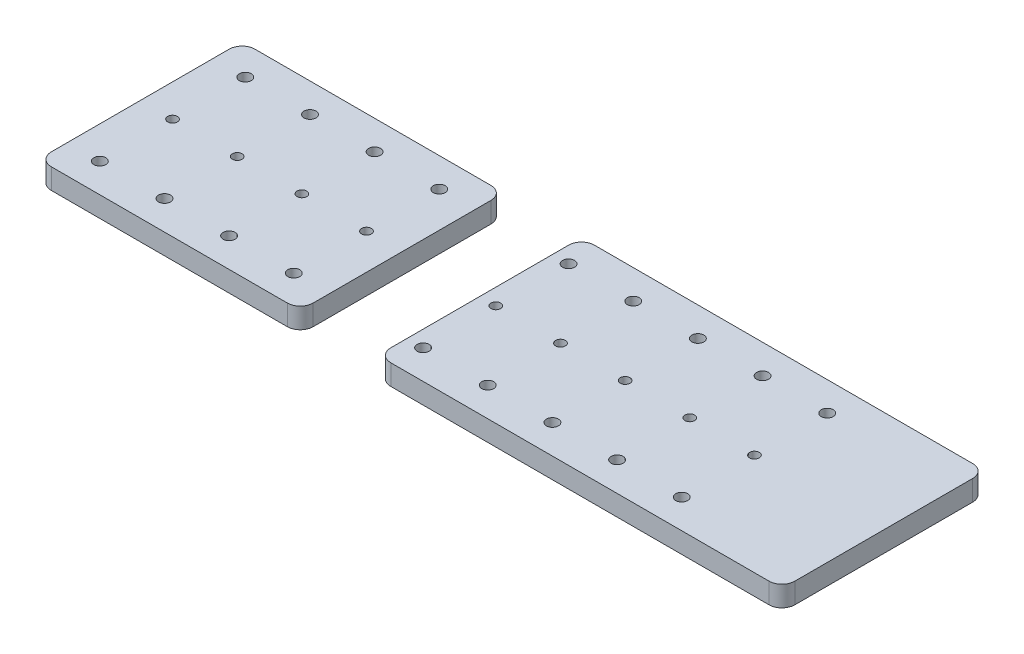
from build123d import *

# Parameters (mm, degrees)
SKETCH1_R           = 1.85
SKETCH1_R_2         = 1.5
BOSS_EXTRUDE1_DEPTH = 6.35
SKETCH3_W           = 24
SKETCH3_H           = 63
CUT_EXTRUDE1_DEPTH  = 233.233874575
FILLET1_R           = 4
FILLET2_R           = 4


with BuildPart() as part:
    # Sketch1 → Boss-Extrude1 (new body)
    with BuildSketch(Plane(origin=(0, 0, 0), x_dir=(1, 0, 0), z_dir=(0, 1, 0))):
        Polygon((0, 0), (0, 31.5), (230, 31.5), (230, -31.5), (0, -31.5), align=None)
        with Locations(Location((10, 22.5, 0), (0, 0, 270))):
            Circle(SKETCH1_R, mode=Mode.SUBTRACT)
        with Locations(Location((30, 22.5, 0), (0, 0, 270))):
            Circle(SKETCH1_R, mode=Mode.SUBTRACT)
        with Locations(Location((50, 22.5, 0), (0, 0, 270))):
            Circle(SKETCH1_R, mode=Mode.SUBTRACT)
        with Locations(Location((70, 22.5, 0), (0, 0, 270))):
            Circle(SKETCH1_R, mode=Mode.SUBTRACT)
        with Locations(Location((90, 22.5, 0), (0, 0, 270))):
            Circle(SKETCH1_R, mode=Mode.SUBTRACT)
        with Locations(Location((110, 22.5, 0), (0, 0, 270))):
            Circle(SKETCH1_R, mode=Mode.SUBTRACT)
        with Locations(Location((130, 22.5, 0), (0, 0, 270))):
            Circle(SKETCH1_R, mode=Mode.SUBTRACT)
        with Locations(Location((150, 22.5, 0), (0, 0, 270))):
            Circle(SKETCH1_R, mode=Mode.SUBTRACT)
        with Locations(Location((170, 22.5, 0), (0, 0, 270))):
            Circle(SKETCH1_R, mode=Mode.SUBTRACT)
        with Locations(Location((10, 0, 0), (0, 0, 270))):
            Circle(SKETCH1_R_2, mode=Mode.SUBTRACT)
        with Locations(Location((30, 0, 0), (0, 0, 270))):
            Circle(SKETCH1_R_2, mode=Mode.SUBTRACT)
        with Locations(Location((50, 0, 0), (0, 0, 270))):
            Circle(SKETCH1_R_2, mode=Mode.SUBTRACT)
        with Locations(Location((70, 0, 0), (0, 0, 270))):
            Circle(SKETCH1_R_2, mode=Mode.SUBTRACT)
        with Locations(Location((90, 0, 0), (0, 0, 270))):
            Circle(SKETCH1_R_2, mode=Mode.SUBTRACT)
        with Locations(Location((110, 0, 0), (0, 0, 270))):
            Circle(SKETCH1_R_2, mode=Mode.SUBTRACT)
        with Locations(Location((170, -22.5, 0), (0, 0, 90))):
            Circle(SKETCH1_R, mode=Mode.SUBTRACT)
        with Locations(Location((150, -22.5, 0), (0, 0, 90))):
            Circle(SKETCH1_R, mode=Mode.SUBTRACT)
        with Locations(Location((130, -22.5, 0), (0, 0, 90))):
            Circle(SKETCH1_R, mode=Mode.SUBTRACT)
        with Locations(Location((110, -22.5, 0), (0, 0, 90))):
            Circle(SKETCH1_R, mode=Mode.SUBTRACT)
        with Locations(Location((90, -22.5, 0), (0, 0, 90))):
            Circle(SKETCH1_R, mode=Mode.SUBTRACT)
        with Locations(Location((70, -22.5, 0), (0, 0, 90))):
            Circle(SKETCH1_R, mode=Mode.SUBTRACT)
        with Locations(Location((50, -22.5, 0), (0, 0, 90))):
            Circle(SKETCH1_R, mode=Mode.SUBTRACT)
        with Locations(Location((30, -22.5, 0), (0, 0, 90))):
            Circle(SKETCH1_R, mode=Mode.SUBTRACT)
        with Locations(Location((10, -22.5, 0), (0, 0, 90))):
            Circle(SKETCH1_R, mode=Mode.SUBTRACT)
        with Locations(Location((130, 0, 0), (0, 0, 270))):
            Circle(SKETCH1_R_2, mode=Mode.SUBTRACT)
        with Locations(Location((150, 0, 0), (0, 0, 270))):
            Circle(SKETCH1_R_2, mode=Mode.SUBTRACT)
        with Locations(Location((170, 0, 0), (0, 0, 270))):
            Circle(SKETCH1_R_2, mode=Mode.SUBTRACT)
        with Locations(Location((190, 22.5, 0), (0, 0, 270))):
            Circle(SKETCH1_R, mode=Mode.SUBTRACT)
        with Locations(Location((190, -22.5, 0), (0, 0, 90))):
            Circle(SKETCH1_R, mode=Mode.SUBTRACT)
        with Locations(Location((190, 0, 0), (0, 0, 270))):
            Circle(SKETCH1_R_2, mode=Mode.SUBTRACT)
    extrude(amount=BOSS_EXTRUDE1_DEPTH)

    # Sketch3 → Cut-Extrude1 (cut, through all)
    with BuildSketch(Plane(origin=(0, 6.35, 0), x_dir=(1, 0, 0), z_dir=(0, 1, 0))):
        with Locations((93, 0)):
            Rectangle(SKETCH3_W, SKETCH3_H)
    extrude(amount=-CUT_EXTRUDE1_DEPTH, mode=Mode.SUBTRACT)


with BuildPart() as cut_extrude1_piece_1:
    # of the separate pieces the step leaves, piece 1, a body of its own (cut_extrude1_pieces)
    add(part.part.solids().sort_by_distance((105, 0, -31.5))[0])

    # Fillet2
    fillet2_edges = [cut_extrude1_piece_1.edges().sort_by_distance(p)[0] for p in [
        (105, 3.175, -31.5),
        (230, 3.175, -31.5),
        (230, 3.175, 31.5),
        (105, 3.175, 31.5),
    ]]
    fillet(fillet2_edges, radius=FILLET2_R)


with BuildPart() as cut_extrude1_piece_2:
    # of the separate pieces the step leaves, piece 2, a body of its own (cut_extrude1_pieces)
    add(part.part.solids().sort_by_distance((0, 0, -31.5))[0])

    # Fillet1
    fillet1_edges = [cut_extrude1_piece_2.edges().sort_by_distance(p)[0] for p in [
        (81, 3.175, 31.5),
        (81, 3.175, -31.5),
        (0, 3.175, -31.5),
        (0, 3.175, 31.5),
    ]]
    fillet(fillet1_edges, radius=FILLET1_R)


solid = Compound([cut_extrude1_piece_1.part, cut_extrude1_piece_2.part])
